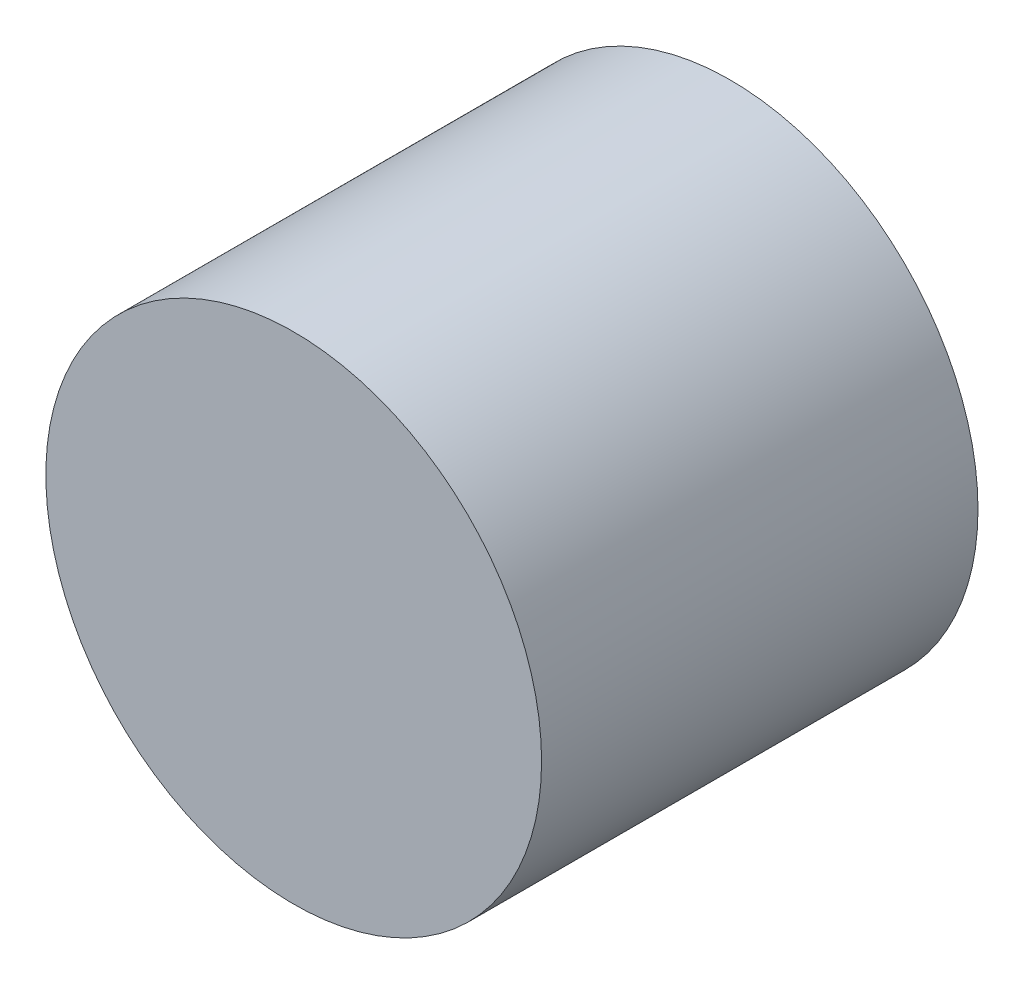
from build123d import *

# Parameters (mm, degrees)
SKIZZE1_R                       = 45.438470597
AUFSATZ_LINEAR_AUSTRAGEN1_DEPTH = 80


with BuildPart() as part:
    # Skizze1 → Aufsatz-Linear austragen1 (new body)
    with BuildSketch(Plane.XY):
        with Locations((17.004176026, 109.694558522)):
            Circle(SKIZZE1_R)
    extrude(amount=AUFSATZ_LINEAR_AUSTRAGEN1_DEPTH)


solid = part.part
